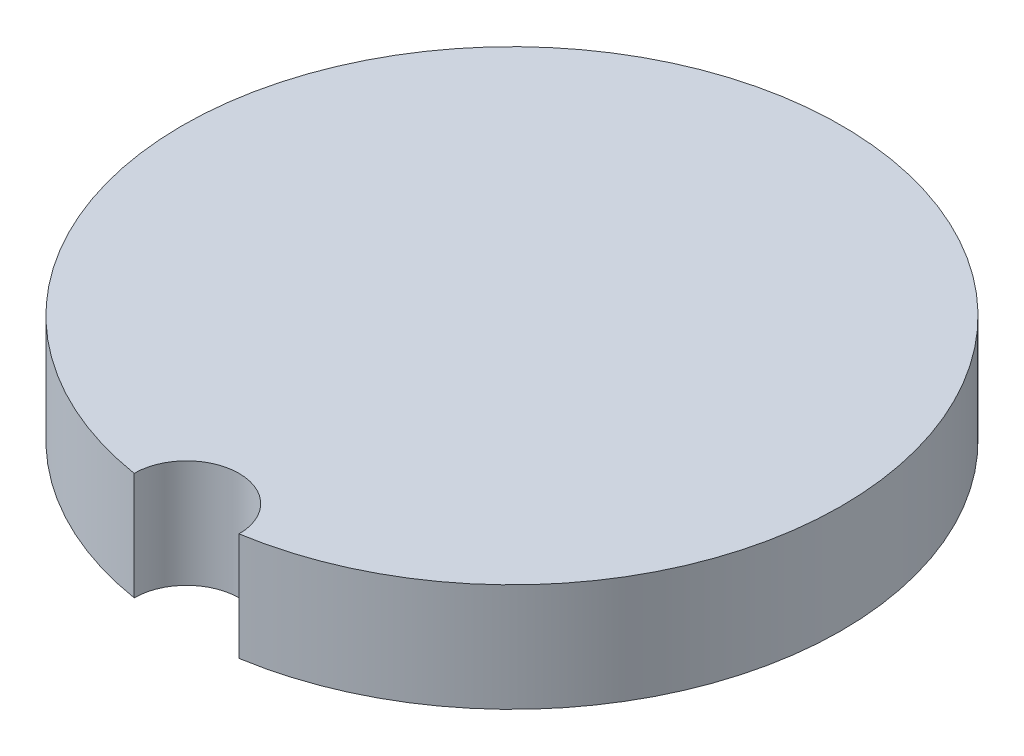
from build123d import *

# Parameters (mm, degrees)
SKETCH1_R           = 22
BOSS_EXTRUDE1_DEPTH = 7.2
SKETCH2_R           = 3.5
CUT_EXTRUDE1_DEPTH  = 32.93493385


with BuildPart() as part:
    # Sketch1 → Boss-Extrude1 (new body)
    with BuildSketch(Plane(origin=(0, 0, 0), x_dir=(1, 0, 0), z_dir=(0, 1, 0))):
        with Locations(Location((0, 0, 0), (0, 0, 270))):
            Circle(SKETCH1_R)
    extrude(amount=BOSS_EXTRUDE1_DEPTH)

    # Sketch2 → Cut-Extrude1 (cut, through all)
    with BuildSketch(Plane.XZ):
        with Locations((0, 21.719806629)):
            Circle(SKETCH2_R)
    extrude(amount=-CUT_EXTRUDE1_DEPTH, mode=Mode.SUBTRACT)


solid = part.part
